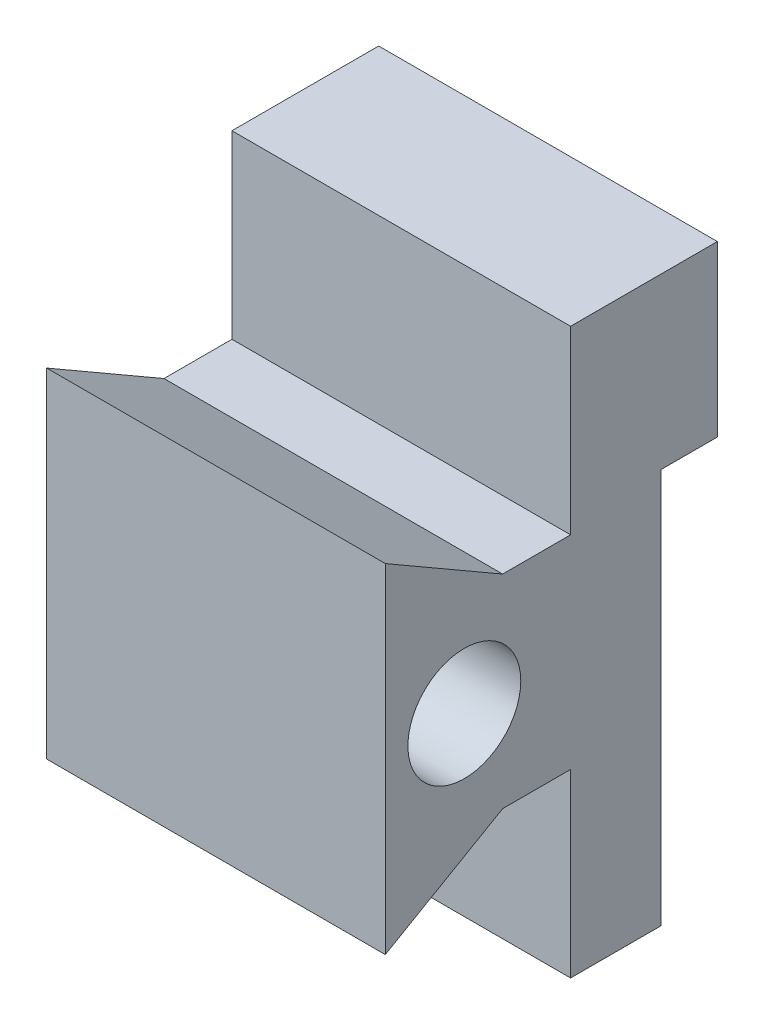
from build123d import *

# Parameters (mm, degrees)
BOSS_EXTRUDE1_DEPTH = 3
SKETCH2_R           = 0.5
CUT_EXTRUDE1_DEPTH  = 5.605420599
SKETCH3_W           = 3
SKETCH3_H           = 1.5
BOSS_EXTRUDE2_DEPTH = 0.5


with BuildPart() as part:
    # Sketch1 → Boss-Extrude1 (new body)
    with BuildSketch(Plane(origin=(0, 0, 0), x_dir=(0, 0, -1), z_dir=(1, 0, 0))):
        Polygon((0, -1.5), (0, 1.5), (1.039230485, 0.9), (1.641290416, 0.9), (1.641290416, 2.5), (2.441290416, 2.5), (2.441290416, -2.5), (1.641290416, -2.5), (1.641290416, -0.9), (1.039230485, -0.9), align=None)
    extrude(amount=BOSS_EXTRUDE1_DEPTH)

    # Sketch2 → Cut-Extrude1 (cut, through all)
    with BuildSketch(Plane(origin=(3, 0, 0), x_dir=(0, 0, -1), z_dir=(1, 0, 0))):
        with Locations((0.7, 0)):
            Circle(SKETCH2_R)
    extrude(amount=-CUT_EXTRUDE1_DEPTH, mode=Mode.SUBTRACT)

    # Sketch3 → Boss-Extrude2 (add)
    with BuildSketch(Plane(origin=(0, 0, -2.441290416), x_dir=(-1, 0, 0), z_dir=(0, 0, -1))):
        with Locations((-1.5, 1.75)):
            Rectangle(SKETCH3_W, SKETCH3_H)
    extrude(amount=BOSS_EXTRUDE2_DEPTH)


solid = part.part
